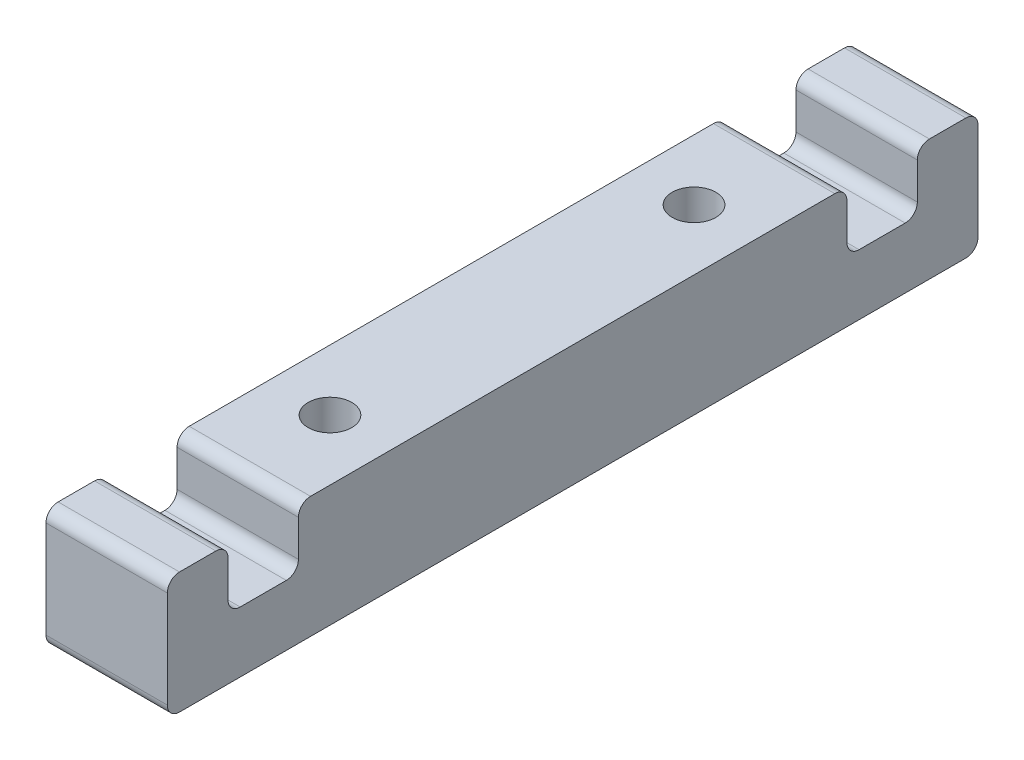
from build123d import *

# Parameters (mm, degrees)
BOSS_EXTRUDE1_DEPTH = 12.7
SKETCH2_R           = 2.286
CUT_EXTRUDE1_DEPTH  = 12.7
FILLET1_R           = 1.27


with BuildPart() as part:
    # Sketch1 → Boss-Extrude1 (new body)
    with BuildSketch(Plane(origin=(0, 0, 0), x_dir=(0, 0, -1), z_dir=(1, 0, 0))):
        Polygon((42.418, 0), (-42.418, 0), (-42.418, 12.7), (-36.068, 12.7), (-36.068, 6.35), (-28.702, 6.35), (-28.702, 12.7), (28.702, 12.7), (28.702, 6.35), (36.068, 6.35), (36.068, 12.7), (42.418, 12.7), align=None)
    extrude(amount=BOSS_EXTRUDE1_DEPTH)

    # Sketch2 → Cut-Extrude1 (cut)
    with BuildSketch(Plane(origin=(0, 12.7, 0), x_dir=(1, 0, 0), z_dir=(0, 1, 0))):
        with Locations(Location((6.35, -19.05, 0), (0, 0, 270))):
            Circle(SKETCH2_R)
        with Locations(Location((6.35, 19.05, 0), (0, 0, 270))):
            Circle(SKETCH2_R)
    extrude(amount=-CUT_EXTRUDE1_DEPTH, mode=Mode.SUBTRACT)

    # Fillet1
    fillet1_edges = [part.edges().sort_by_distance(p)[0] for p in [
        (6.35, 12.7, 42.418),
        (6.35, 12.7, 36.068),
        (6.35, 6.35, 36.068),
        (6.35, 6.35, 28.702),
        (6.35, 12.7, 28.702),
        (6.35, 12.7, -28.702),
        (6.35, 6.35, -28.702),
        (6.35, 6.35, -36.068),
        (6.35, 12.7, -36.068),
        (6.35, 12.7, -42.418),
        (6.35, 0, -42.418),
        (6.35, 0, 42.418),
    ]]
    fillet(fillet1_edges, radius=FILLET1_R)


solid = part.part
